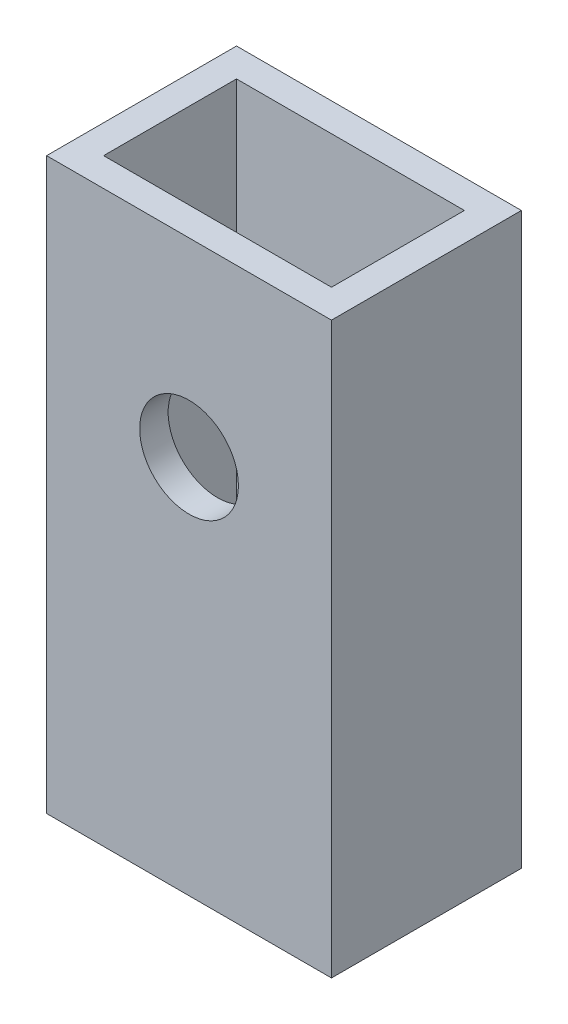
from build123d import *

# Parameters (mm, degrees)
SKETCH_1_W          = 15
SKETCH_1_H          = 10
EXTRUDE_1_DEPTH     = 30
SKETCH_2_W          = 12
SKETCH_2_H          = 7
CUT_EXTRUDE_1_DEPTH = 28.5
SKETCH_3_R          = 2.6
CUT_EXTRUDE_2_DEPTH = 33.5
SKETCH_4_R          = 1.6
CUT_EXTRUDE_3_DEPTH = 1.5


with BuildPart() as part:
    # 草图1 → 凸台-拉伸1 (new body)
    with BuildSketch(Plane(origin=(0, 0, 0), x_dir=(1, 0, 0), z_dir=(0, 1, 0))):
        Rectangle(SKETCH_1_W, SKETCH_1_H)
    extrude(amount=EXTRUDE_1_DEPTH)

    # 草图2 → 切除-拉伸1 (cut)
    with BuildSketch(Plane(origin=(0, 30, 0), x_dir=(1, 0, 0), z_dir=(0, 1, 0))):
        Rectangle(SKETCH_2_W, SKETCH_2_H)
    extrude(amount=-CUT_EXTRUDE_1_DEPTH, mode=Mode.SUBTRACT)

    # 草图3 → 切除-拉伸2 (cut, through all)
    with BuildSketch(Plane.XY.offset(5)):
        with Locations((0, 20)):
            Circle(SKETCH_3_R)
    extrude(amount=-CUT_EXTRUDE_2_DEPTH, mode=Mode.SUBTRACT)

    # 草图4 → 切除-拉伸3 (cut)
    with BuildSketch(Plane(origin=(0, 0, -5), x_dir=(-1, 0, 0), z_dir=(0, 0, -1))):
        with Locations((0, 6.25)):
            Circle(SKETCH_4_R)
    extrude(amount=-CUT_EXTRUDE_3_DEPTH, mode=Mode.SUBTRACT)


solid = part.part
